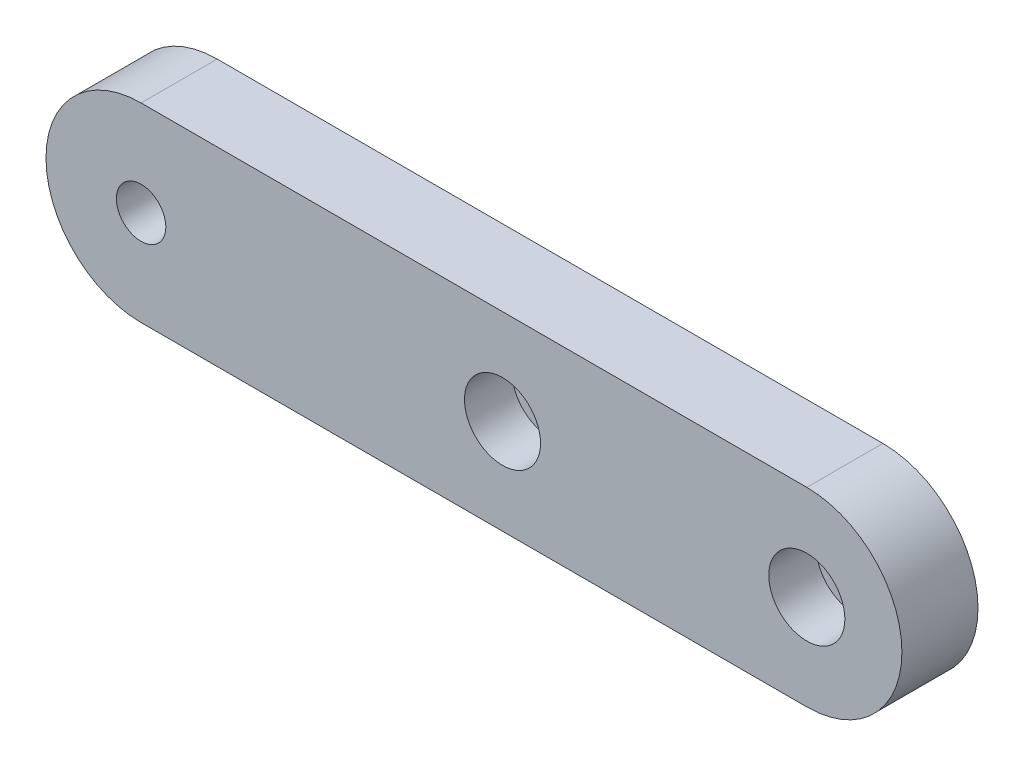
from build123d import *

# Parameters (mm, degrees)
ESQUISSE1_W             = 35
ESQUISSE1_H             = 10
BOSS_EXTRU_1_DEPTH      = 4
ENL_V_MAT_EXTRU_1_REACH = 25.393
ESQUISSE2_R             = 1.19126
ESQUISSE2_R_2           = 1.3
ESQUISSE4_R             = 2
ENL_V_MAT_EXTRU_2_DEPTH = 2.5


with BuildPart() as part:
    # Esquisse1 → Boss.-Extru.1 (new body)
    with BuildSketch(Plane.XY):
        Rectangle(ESQUISSE1_W, ESQUISSE1_H)
        with BuildLine():
            ThreePointArc((17.5, 5), (22.5, 0), (17.5, -5))
            Line((17.5, -5), (17.5, 5))
        make_face()
        with BuildLine():
            ThreePointArc((-17.5, -5), (-22.5, 0), (-17.5, 5))
            Line((-17.5, 5), (-17.5, -5))
        make_face()
    extrude(amount=BOSS_EXTRU_1_DEPTH)

    # Esquisse2 → Enlèv. mat.-Extru.1 (cut, up to next)
    with BuildSketch(Plane.XY.offset(4), mode=Mode.PRIVATE) as enl_v_mat_extru_1_sk1:
        with Locations((17.5, 0)):
            Circle(ESQUISSE2_R)
    enl_v_mat_extru_1_tool1 = extrude(enl_v_mat_extru_1_sk1.sketch, amount=-ENL_V_MAT_EXTRU_1_REACH, mode=Mode.PRIVATE) & part.part
    # Esquisse2 → Enlèv. mat.-Extru.1 (cut, up to next)
    with BuildSketch(Plane.XY.offset(4), mode=Mode.PRIVATE) as enl_v_mat_extru_1_sk2:
        with Locations((1.50054, 0)):
            Circle(ESQUISSE2_R)
    enl_v_mat_extru_1_tool2 = extrude(enl_v_mat_extru_1_sk2.sketch, amount=-ENL_V_MAT_EXTRU_1_REACH, mode=Mode.PRIVATE) & part.part
    # Esquisse2 → Enlèv. mat.-Extru.1 (cut, up to next)
    with BuildSketch(Plane.XY.offset(4), mode=Mode.PRIVATE) as enl_v_mat_extru_1_sk3:
        with Locations((-17.5, 0)):
            Circle(ESQUISSE2_R_2)
    enl_v_mat_extru_1_tool3 = extrude(enl_v_mat_extru_1_sk3.sketch, amount=-ENL_V_MAT_EXTRU_1_REACH, mode=Mode.PRIVATE) & part.part
    add(enl_v_mat_extru_1_tool1.solids().sort_by_distance((17.5, 0, 4))[0], mode=Mode.SUBTRACT)
    add(enl_v_mat_extru_1_tool2.solids().sort_by_distance((1.50054, 0, 4))[0], mode=Mode.SUBTRACT)
    add(enl_v_mat_extru_1_tool3.solids().sort_by_distance((-17.5, 0, 4))[0], mode=Mode.SUBTRACT)

    # Esquisse4 → Enlèv. mat.-Extru.2 (cut)
    with BuildSketch(Plane.XY.offset(4)):
        with Locations((17.5, 0)):
            Circle(ESQUISSE4_R)
        with Locations((1.50054, 0)):
            Circle(ESQUISSE4_R)
    extrude(amount=-ENL_V_MAT_EXTRU_2_DEPTH, mode=Mode.SUBTRACT)


solid = part.part
